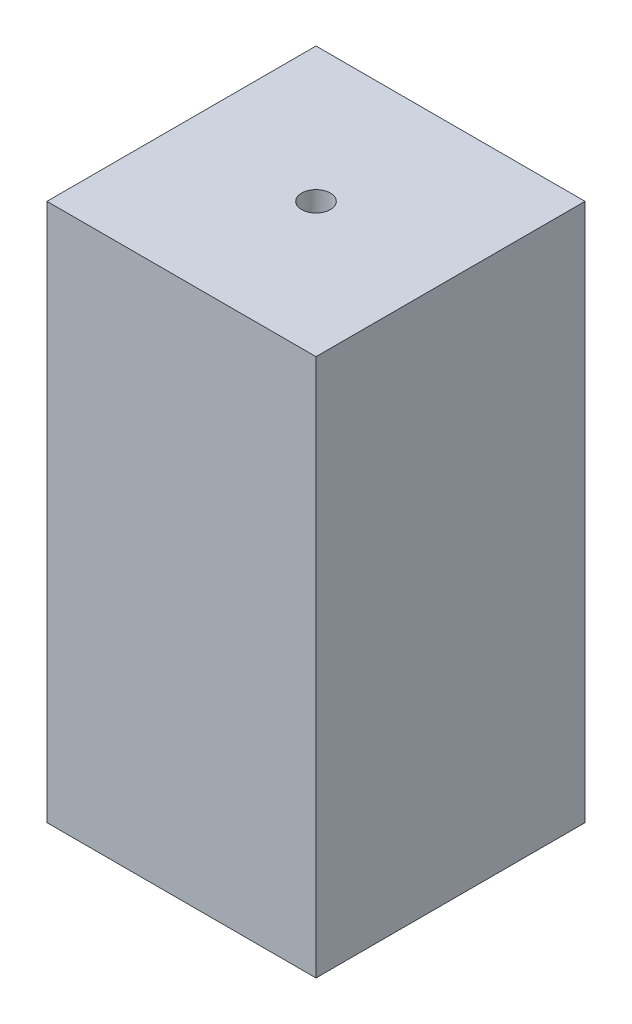
from build123d import *

# Parameters (mm, degrees)
CROQUIS_BASE_W             = 75
CROQUIS_BASE_H             = 75
COLUMNA_75X150_DEPTH       = 150
CROQUIS_AGUJEROS_MONTAJE_R = 4
AGUJERO_INSERTO_M6_DEPTH   = 14
AGUJERO_SUPERIOR_M6_START  = -14
CROQUIS_AGUJERO_SUPERIOR_R = 4
AGUJERO_SUPERIOR_M6_DEPTH  = 14


with BuildPart() as part:
    # Croquis_base → Columna_75x150 (new body)
    with BuildSketch(Plane(origin=(0, 0, 0), x_dir=(1, 0, 0), z_dir=(0, 1, 0))):
        Rectangle(CROQUIS_BASE_W, CROQUIS_BASE_H)
    extrude(amount=COLUMNA_75X150_DEPTH)

    # Croquis_agujeros_montaje → Agujero_inserto_M6 (cut)
    with BuildSketch(Plane(origin=(0, 0, 0), x_dir=(1, 0, 0), z_dir=(0, 1, 0))):
        with Locations(Location((0, 0, 0), (0, 0, 270))):
            Circle(CROQUIS_AGUJEROS_MONTAJE_R)
    extrude(amount=AGUJERO_INSERTO_M6_DEPTH, mode=Mode.SUBTRACT)

    # Croquis_agujero_superior → Agujero_superior_M6 (cut)
    with BuildSketch(Plane(origin=(0, 150, 0), x_dir=(1, 0, 0), z_dir=(0, 1, 0)).offset(AGUJERO_SUPERIOR_M6_START)):
        with Locations(Location((0, 0, 0), (0, 0, 270))):
            Circle(CROQUIS_AGUJERO_SUPERIOR_R)
    extrude(amount=AGUJERO_SUPERIOR_M6_DEPTH, mode=Mode.SUBTRACT)


solid = part.part
